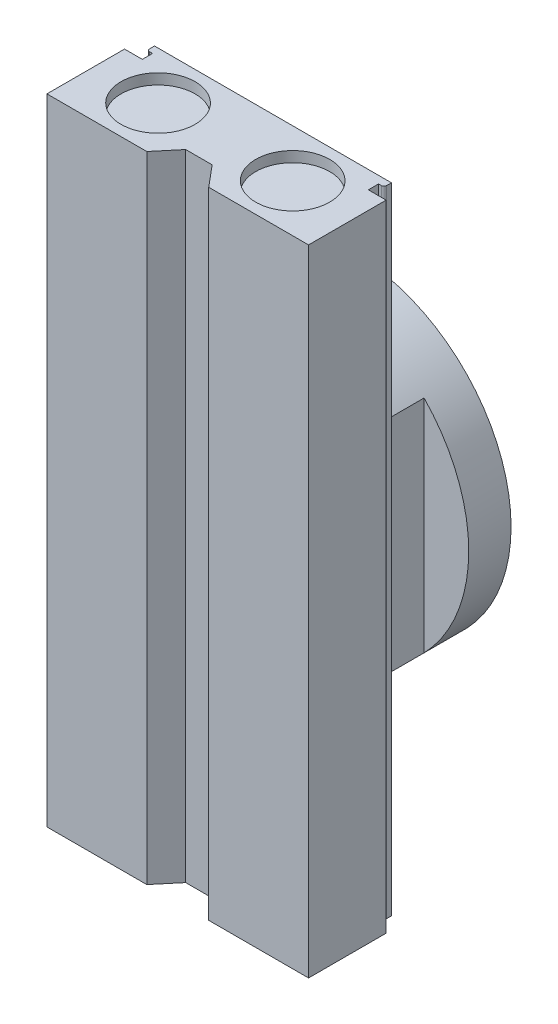
from build123d import *

# Parameters (mm, degrees)
ESQUISSE1_R             = 30
BOSS_EXTRU_1_DEPTH      = 15
ESQUISSE2_W             = 9.340839883
ESQUISSE2_H             = 53.061818545
ENL_V_MAT_EXTRU_1_DEPTH = 7
ESQUISSE3_W             = 49.4498788
ESQUISSE3_H             = 120
BOSS_EXTRU_2_DEPTH      = 18
ESQUISSE4_R             = 7
ENL_V_MAT_EXTRU_2_DEPTH = 2
ENL_V_MAT_EXTRU_3_DEPTH = 129.01952976
ESQUISSE6_R             = 10
BOSS_EXTRU_3_DEPTH      = 10
ESQUISSE7_W             = 5
ESQUISSE7_H             = 120
ENL_V_MAT_EXTRU_4_DEPTH = 4
D_POUILLE1_ANGLE        = 40


with BuildPart() as part:
    # Esquisse1 → Boss.-Extru.1 (new body)
    with BuildSketch(Plane.XY):
        Circle(ESQUISSE1_R)
    extrude(amount=BOSS_EXTRU_1_DEPTH)

    # Esquisse2 → Enlèv. mat.-Extru.1 (cut)
    with BuildSketch(Plane.XY.offset(15)):
        with Locations((26.230396322, -0.346809271)):
            Rectangle(ESQUISSE2_W, ESQUISSE2_H)
        with Locations((-26.230396322, -0.346809271)):
            Rectangle(ESQUISSE2_W, ESQUISSE2_H)
    extrude(amount=-ENL_V_MAT_EXTRU_1_DEPTH, mode=Mode.SUBTRACT)

    # Esquisse3 → Boss.-Extru.2 (add)
    with BuildSketch(Plane.XY.offset(15)):
        Rectangle(ESQUISSE3_W, ESQUISSE3_H)
    extrude(amount=BOSS_EXTRU_2_DEPTH)

    # Esquisse4 → Enlèv. mat.-Extru.2 (cut)
    with BuildSketch(Plane.XZ.offset(60)):
        with Locations(Location((12.7249394, 24, 0), (0, 0, 270))):
            Circle(ESQUISSE4_R)
        with Locations(Location((-12.7249394, 24, 0), (0, 0, 270))):
            Circle(ESQUISSE4_R)
    enl_v_mat_extru_2 = extrude(amount=-ENL_V_MAT_EXTRU_2_DEPTH, mode=Mode.SUBTRACT)

    # Symétrie1: Enlèv. mat.-Extru.2 across plane
    add(enl_v_mat_extru_2.mirror(Plane.ZX), mode=Mode.SUBTRACT)

    # Esquisse5 → Enlèv. mat.-Extru.3 (cut, through all)
    with BuildSketch(Plane.XZ.offset(60)):
        with BuildLine():
            Line((24.7249394, 18.33578408), (21.356248325, 18.33578408))
            Line((21.356248325, 18.33578408), (21.356248325, 16.410354936))
            Line((21.356248325, 16.410354936), (21.889577151, 16.410354936))
            ThreePointArc((21.889577151, 16.410354936), (22.243130541, 16.263908326), (22.389577151, 15.910354936))
            Line((22.389577151, 15.910354936), (22.389577151, 15))
            Line((22.389577151, 15), (22.700668624, 13.139727122))
            Line((22.700668624, 13.139727122), (26.027148326, 13.139727122))
            Line((26.027148326, 13.139727122), (26.027148326, 18.33578408))
            Line((26.027148326, 18.33578408), (24.7249394, 18.33578408))
        make_face()
        with BuildLine():
            Line((-22.389577151, 15.910354936), (-22.389577151, 15))
            Line((-22.389577151, 15), (-22.389577151, 13.757493185))
            Line((-22.389577151, 13.757493185), (-25.545793937, 13.757493185))
            Line((-25.545793937, 13.757493185), (-25.842888818, 18.33578408))
            Line((-25.842888818, 18.33578408), (-24.7249394, 18.33578408))
            Line((-24.7249394, 18.33578408), (-21.356248325, 18.33578408))
            Line((-21.356248325, 18.33578408), (-21.356248325, 16.410354936))
            Line((-21.356248325, 16.410354936), (-21.889577151, 16.410354936))
            ThreePointArc((-21.889577151, 16.410354936), (-22.243130541, 16.263908326), (-22.389577151, 15.910354936))
        make_face()
    extrude(amount=-ENL_V_MAT_EXTRU_3_DEPTH, mode=Mode.SUBTRACT)

    # Esquisse6 → Boss.-Extru.3 (add)
    with BuildSketch(Plane(origin=(0, 0, 0), x_dir=(-1, 0, 0), z_dir=(0, 0, -1))):
        with Locations(Location((0, 0, 0), (0, 0, 180))):
            Circle(ESQUISSE6_R)
    extrude(amount=BOSS_EXTRU_3_DEPTH)

    # Esquisse7 → Enlèv. mat.-Extru.4 (cut)
    with BuildSketch(Plane.XY.offset(33)):
        Rectangle(ESQUISSE7_W, ESQUISSE7_H)
    extrude(amount=-ENL_V_MAT_EXTRU_4_DEPTH, mode=Mode.SUBTRACT)

    # Dépouille1
    d_pouille1_faces = [part.faces().sort_by_distance(p)[0] for p in [
        (-2.5, 0, 31),
        (2.5, 0, 31),
    ]]
    draft(d_pouille1_faces, Plane(origin=(-2.5, 60, 29), x_dir=(1, 0, 0), z_dir=(0, 0, 1)), D_POUILLE1_ANGLE)


solid = part.part
